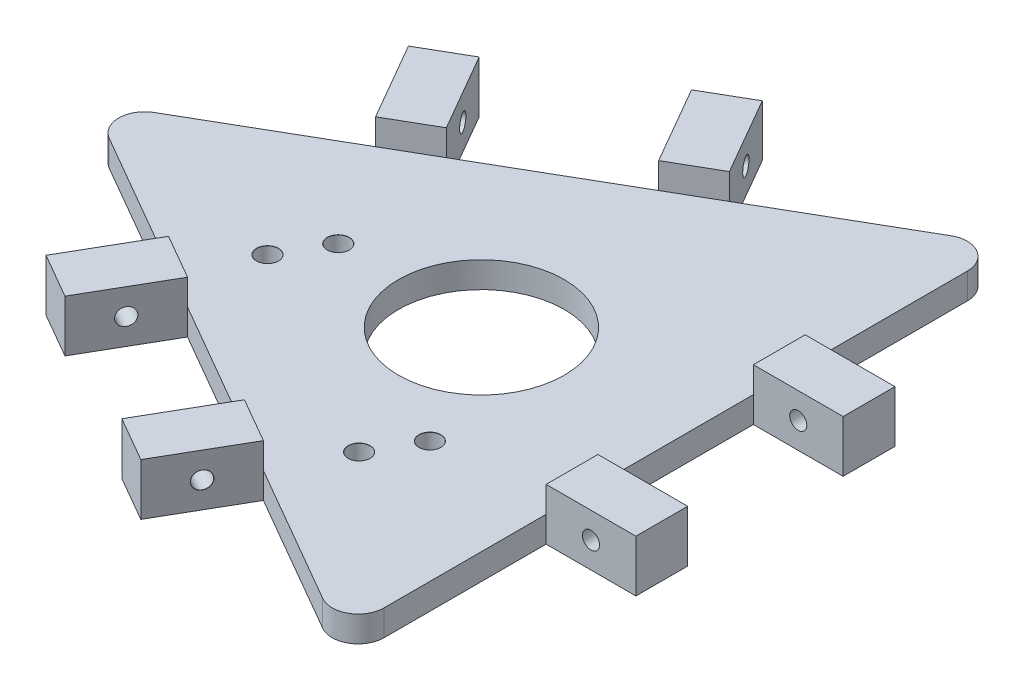
from build123d import *

# Parameters (mm, degrees)
BOSS_EXTRUDE1_DEPTH               = 5
BOSS_EXTRUDE3_DEPTH               = 10
TAP_DRILL_FOR_M4_TAP1_D           = 3.3
TAP_DRILL_FOR_M4_TAP1_CSINK_D     = 3.35
TAP_DRILL_FOR_M4_TAP1_CSINK_ANGLE = 90
CIRPATTERN1_COUNT                 = 3
SKETCH13_R                        = 16
CUT_EXTRUDE1_DEPTH                = 94.577061893
TAP_DRILL_FOR_M5_TAP1_D           = 4.2
TAP_DRILL_FOR_M5_TAP1_CSINK_D     = 4.25
TAP_DRILL_FOR_M5_TAP1_CSINK_ANGLE = 90


with BuildPart() as part:
    # Sketch2 → Boss-Extrude1 (new body)
    with BuildSketch(Plane(origin=(0, 0, 0), x_dir=(0, 0, -1), z_dir=(0, 1, 0))):
        with BuildLine():
            Line((4.330127019, 67.5), (19.975952642, 40.400635095))
            Line((19.975952642, 40.400635095), (24.975952642, 31.740381057))
            Line((24.975952642, 31.740381057), (39.975952642, 5.759618943))
            Line((39.975952642, 5.759618943), (44.975952642, -2.900635095))
            Line((44.975952642, -2.900635095), (60.621778265, -30))
            ThreePointArc((60.621778265, -30), (60.621778265, -35), (56.291651246, -37.5))
            Line((56.291651246, -37.5), (25, -37.5))
            Line((25, -37.5), (15, -37.5))
            Line((15, -37.5), (-15, -37.5))
            Line((-15, -37.5), (-25, -37.5))
            Line((-25, -37.5), (-56.291651246, -37.5))
            ThreePointArc((-56.291651246, -37.5), (-60.621778265, -35), (-60.621778265, -30))
            Line((-60.621778265, -30), (-44.975952642, -2.900635095))
            Line((-44.975952642, -2.900635095), (-39.975952642, 5.759618943))
            Line((-39.975952642, 5.759618943), (-24.975952642, 31.740381057))
            Line((-24.975952642, 31.740381057), (-19.975952642, 40.400635095))
            Line((-19.975952642, 40.400635095), (-4.330127019, 67.5))
            ThreePointArc((-4.330127019, 67.5), (0, 70), (4.330127019, 67.5))
        make_face()
    extrude(amount=BOSS_EXTRUDE1_DEPTH)

    # Sketch2<7> → Boss-Extrude3 (add)
    with BuildSketch(Plane(origin=(0, 0, 0), x_dir=(0, 0, -1), z_dir=(0, 1, 0))):
        Polygon((34.975952642, 49.060889132), (19.975952642, 40.400635095), (24.975952642, 31.740381057), (39.975952642, 40.400635095), align=None)
        Polygon((39.975952642, 5.759618943), (44.975952642, -2.900635095), (59.975952642, 5.759618943), (54.975952642, 14.419872981), align=None)
    boss_extrude3 = extrude(amount=BOSS_EXTRUDE3_DEPTH)

    # Tap Drill for M4 Tap1 (through all)
    with Locations(Plane(origin=(-21.650635095, 0, 12.5), x_dir=(0.49999999999999517, 0, 0.8660254037844415), z_dir=(-0.8660254037844414, 0, 0.4999999999999951))):
        with Locations((-46.160254038, 5)):
            tap_drill_for_m4_tap1 = CounterSinkHole(TAP_DRILL_FOR_M4_TAP1_D / 2, TAP_DRILL_FOR_M4_TAP1_CSINK_D / 2, counter_sink_angle=TAP_DRILL_FOR_M4_TAP1_CSINK_ANGLE)

    # CirPattern1: Boss-Extrude3, Tap Drill for M4 Tap1 ×3 about axis
    cirpattern1_axis = Axis((0, 5, 0), (0, 1, 0))
    add([boss_extrude3.rotate(cirpattern1_axis, i * 360 / CIRPATTERN1_COUNT) for i in range(1, CIRPATTERN1_COUNT)])
    add([tap_drill_for_m4_tap1.rotate(cirpattern1_axis, i * 360 / CIRPATTERN1_COUNT) for i in range(1, CIRPATTERN1_COUNT)], mode=Mode.SUBTRACT)

    # Sketch13 → Cut-Extrude1 (cut, through all)
    with BuildSketch(Plane.XZ):
        with Locations((0.00701443, 0.012149349)):
            Circle(SKETCH13_R)
    extrude(amount=-CUT_EXTRUDE1_DEPTH, mode=Mode.SUBTRACT)

    # Tap Drill for M5 Tap1 (through all)
    with Locations(Plane(origin=(0, 5, 0), x_dir=(1, 0, 0), z_dir=(0, 1, 0))):
        with Locations((-27.789778361, 0.166691947), (-32.789778361, -8.49356209), (14.039248642, -23.983308053), (9.039248642, -32.64356209)):
            CounterSinkHole(TAP_DRILL_FOR_M5_TAP1_D / 2, TAP_DRILL_FOR_M5_TAP1_CSINK_D / 2, counter_sink_angle=TAP_DRILL_FOR_M5_TAP1_CSINK_ANGLE)


solid = part.part
